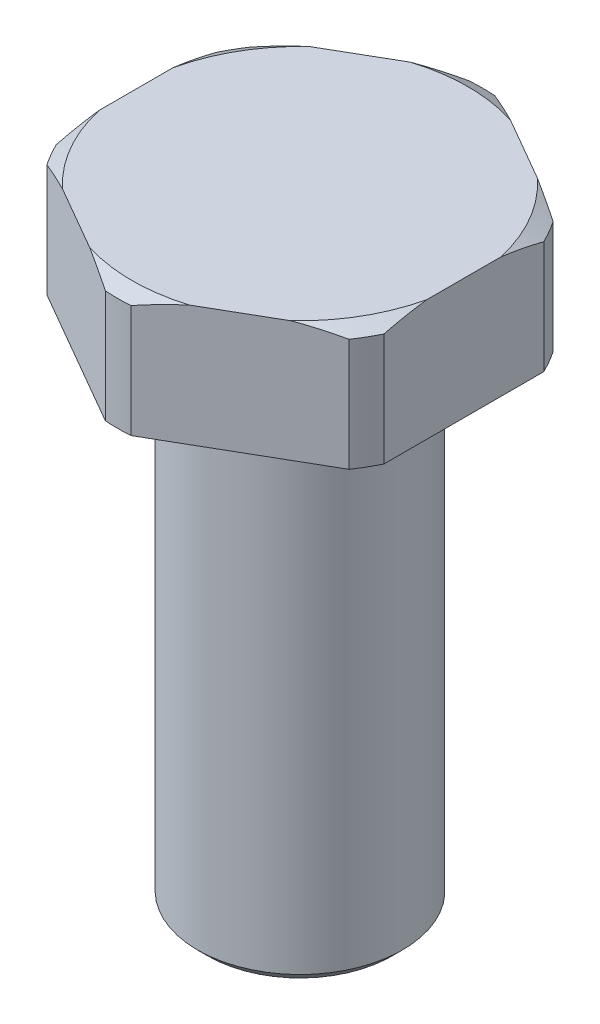
from build123d import *

# Parameters (mm, degrees)
SZKIC2_OUTSIDE_W           = 27.694
SZKIC2_OUTSIDE_H           = 27.694
WYTNIJ_WYCI_GNI_CIE1_DEPTH = 30.4


with BuildPart() as part:
    # Szkic1 → Obrót1 (revolve)
    with BuildSketch(Plane.XY, mode=Mode.PRIVATE) as obr_t1_sk:
        Polygon((0, 6.4), (8.2, 6.4), (8.9, 5.995854812), (8.9, 0.5), (7.3, 0.5), (7.3, 0), (5, 0), (5, -23.5), (4.5, -24), (0, -24), align=None)
    revolve(obr_t1_sk.sketch.rotate(Axis((0, 37.287865055, 0), (0, -1, 0)), 90), axis=Axis((0, 37.287865055, 0), (0, -1, 0)))

    # Szkic2 outside → Wytnij-wyciągnięcie1 (cut)
    with BuildSketch(Plane(origin=(0, 6.4, 0), x_dir=(1, 0, 0), z_dir=(0, 1, 0))):
        Rectangle(SZKIC2_OUTSIDE_W, SZKIC2_OUTSIDE_H)
        Polygon((0, 9.237604307), (-8, 4.618802154), (-8, -4.618802154), (0, -9.237604307), (8, -4.618802154), (8, 4.618802154), align=None, mode=Mode.SUBTRACT)
    extrude(amount=-WYTNIJ_WYCI_GNI_CIE1_DEPTH, mode=Mode.SUBTRACT)


solid = part.part
